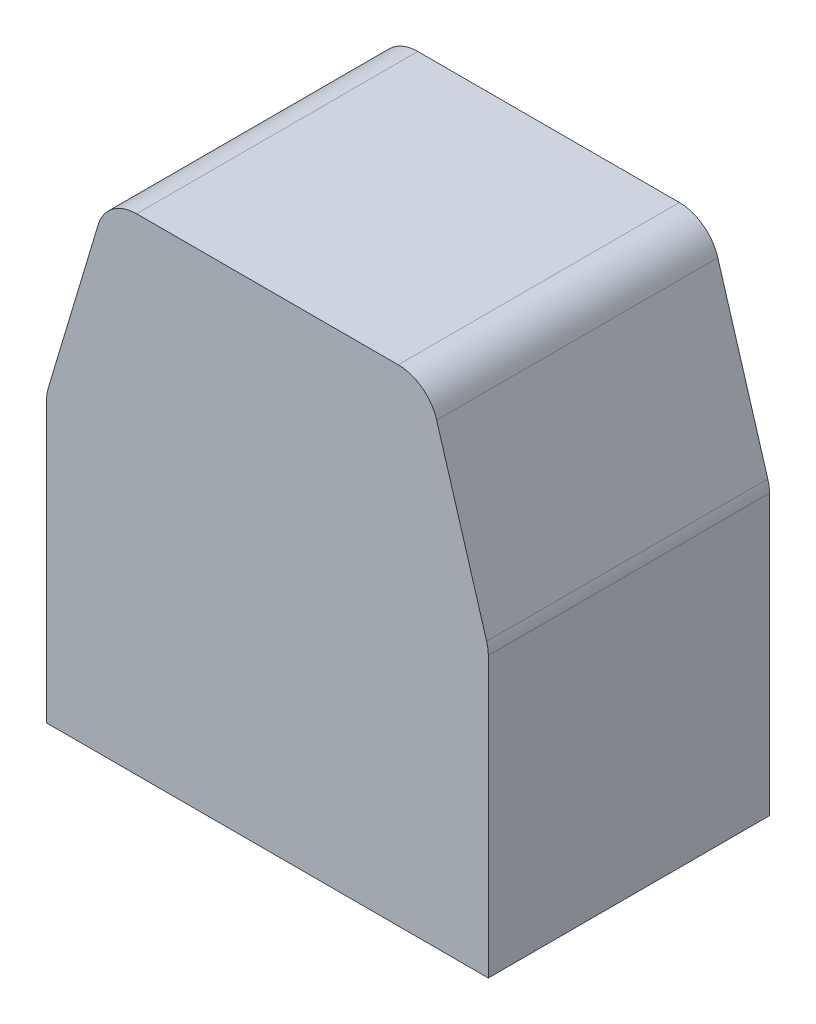
from build123d import *

# Parameters (mm, degrees)
EXTRUDE_4_DEPTH = 70
EXTRUDE_START   = -5
EXTRUDE_5_DEPTH = 5


with BuildPart() as part:
    # 草图1 → 凸台-拉伸4 (new body)
    with BuildSketch(Plane.XY):
        with BuildLine():
            Line((-52.598076211, -29), (-50, -30.5))
            Line((-50, -30.5), (-50, 35.5))
            Line((-50, 35.5), (-38.637956343, 73.373478856))
            ThreePointArc((-38.637956343, 73.373478856), (-35.028998787, 78.522929283), (-29.059693491, 80.5))
            Line((-29.059693491, 80.5), (0, 80.5))
            Line((0, 80.5), (29.059693491, 80.5))
            ThreePointArc((29.059693491, 80.5), (35.028998787, 78.522929283), (38.637956343, 73.373478856))
            Line((38.637956343, 73.373478856), (50, 35.5))
            Line((50, 35.5), (50, -30.5))
            Line((50, -30.5), (52.598076211, -29))
            Line((52.598076211, -29), (52.598076211, -34))
            Line((52.598076211, -34), (50, -32.5))
            Line((50, -32.5), (50, -35.5))
            Line((50, -35.5), (55, -35.5))
            Line((55, -35.5), (55, 34.032311637))
            ThreePointArc((55, 34.032311637), (54.894003955, 35.484443084), (54.578262852, 36.905790493))
            Line((54.578262852, 36.905790493), (42.137956343, 78.373478856))
            ThreePointArc((42.137956343, 78.373478856), (38.528998787, 83.522929283), (32.559693491, 85.5))
            Line((32.559693491, 85.5), (0, 85.5))
            Line((0, 85.5), (-32.559693491, 85.5))
            ThreePointArc((-32.559693491, 85.5), (-38.528998787, 83.522929283), (-42.137956343, 78.373478856))
            Line((-42.137956343, 78.373478856), (-54.578262852, 36.905790493))
            ThreePointArc((-54.578262852, 36.905790493), (-54.894003955, 35.484443084), (-55, 34.032311637))
            Line((-55, 34.032311637), (-55, -35.5))
            Line((-55, -35.5), (-50, -35.5))
            Line((-50, -35.5), (-50, -32.5))
            Line((-50, -32.5), (-52.598076211, -34))
            Line((-52.598076211, -34), (-52.598076211, -29))
        make_face()
    extrude(amount=EXTRUDE_4_DEPTH)

    # 草图2 → 凸台-拉伸5 (add)
    with BuildSketch(Plane.XY.offset(70).offset(EXTRUDE_START)):
        with BuildLine():
            Line((-50, -35.5), (50, -35.5))
            Line((50, -35.5), (50, -32.5))
            Line((50, -32.5), (52.598076211, -34))
            Line((52.598076211, -34), (52.598076211, -29))
            Line((52.598076211, -29), (50, -30.5))
            Line((50, -30.5), (50, 35.5))
            Line((50, 35.5), (38.637956343, 73.373478856))
            ThreePointArc((38.637956343, 73.373478856), (35.028998787, 78.522929283), (29.059693491, 80.5))
            Line((29.059693491, 80.5), (-29.059693491, 80.5))
            ThreePointArc((-29.059693491, 80.5), (-35.028998787, 78.522929283), (-38.637956343, 73.373478856))
            Line((-38.637956343, 73.373478856), (-50, 35.5))
            Line((-50, 35.5), (-50, -30.5))
            Line((-50, -30.5), (-52.598076211, -29))
            Line((-52.598076211, -29), (-52.598076211, -34))
            Line((-52.598076211, -34), (-50, -32.5))
            Line((-50, -32.5), (-50, -35.5))
        make_face()
    extrude(amount=EXTRUDE_5_DEPTH)


solid = part.part
